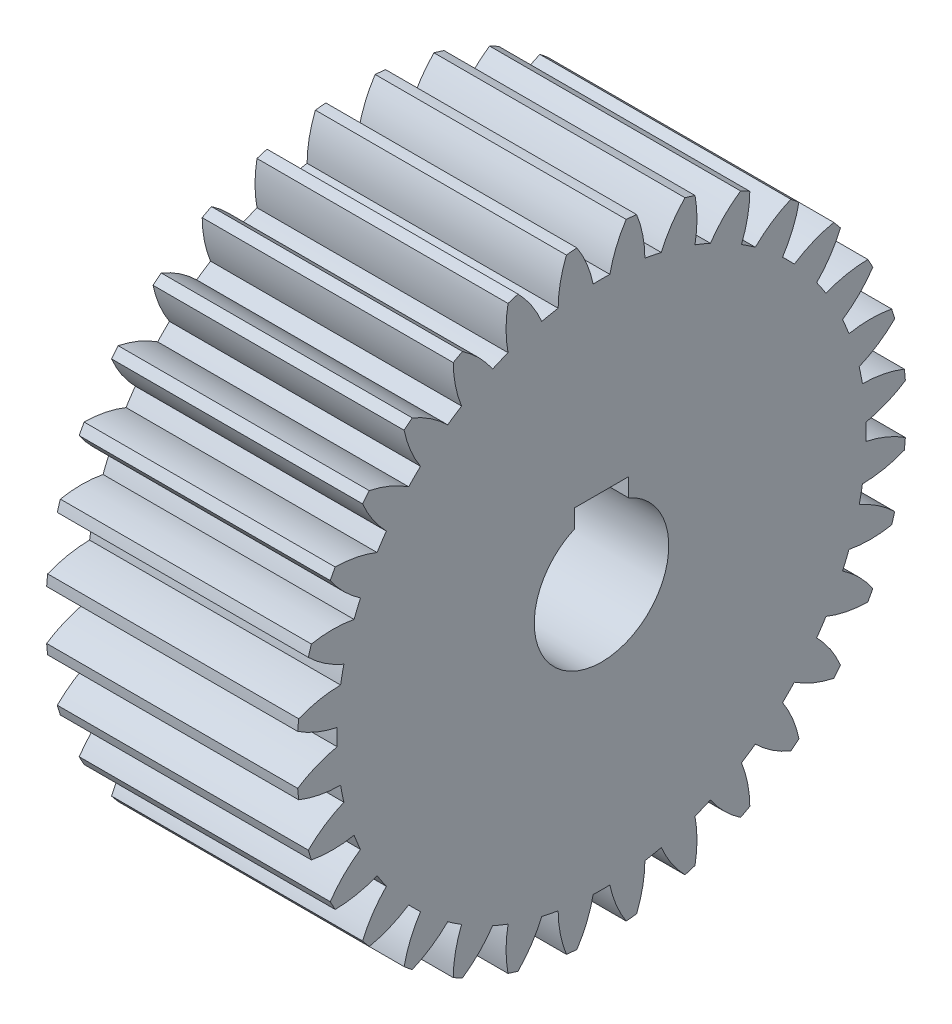
from build123d import *

# Parameters (mm, degrees)
BASPROSKE_W     = 59.266666667
BASPROSKE_H     = 71.966666667
TOOTHCUT_DEPTH  = 118.774954893
TEETHCUTS_COUNT = 32
TEETHCUTS_ANGLE = 348.75
BORSKE_R        = 15.875
BORE_DEPTH      = 59.266717467
KEYSKE_W        = 12.7
KEYSKE_H        = 18.8468
KEYWAY_DEPTH    = 59.266717467


with BuildPart() as part:
    # BasProSke → Base-Revolve (revolve)
    with BuildSketch(Plane(origin=(0, 0, 0), x_dir=(1, 0, 0), z_dir=(0, 1, 0)), mode=Mode.PRIVATE) as base_revolve_sk:
        with Locations((29.633333334, 35.983333333)):
            Rectangle(BASPROSKE_W, BASPROSKE_H)
    revolve(base_revolve_sk.sketch.rotate(Axis((-10, 0, 0), (1, 0, 0)), 180), axis=Axis((-10, 0, 0), (1, 0, 0)))

    # TooCutSke → ToothCut (cut, through all)
    with BuildSketch(Plane(origin=(0, 0, 0), x_dir=(0, 0, -1), z_dir=(1, 0, 0))):
        with BuildLine():
            ThreePointArc((1.971598238, 62.409261623), (0, 62.440396667), (-1.971598238, 62.409261623))
            ThreePointArc((-1.971598238, 62.409261623), (-3.464028334, 67.264109672), (-5.836343479, 71.75510266))
            ThreePointArc((-5.836343479, 71.75510266), (0, 71.992066667), (5.836343479, 71.75510266))
            ThreePointArc((5.836343479, 71.75510266), (3.464028334, 67.264109672), (1.971598238, 62.409261623))
        make_face()
    toothcut = extrude(amount=TOOTHCUT_DEPTH, mode=Mode.SUBTRACT)

    # TeethCuts: ToothCut ×32 about axis
    teethcuts_axis = Axis((-10, 0, 0), (1, 0, 0))
    for i in range(1, TEETHCUTS_COUNT):
        add(toothcut.rotate(teethcuts_axis, i * TEETHCUTS_ANGLE / (TEETHCUTS_COUNT - 1)), mode=Mode.SUBTRACT)

    # BorSke → Bore (cut, symmetric)
    with BuildSketch(Plane(origin=(0, 0, 0), x_dir=(0, 0, -1), z_dir=(1, 0, 0))):
        with Locations(Location((0, 0, 0), (0, 0, 180))):
            Circle(BORSKE_R)
    extrude(amount=BORE_DEPTH, both=True, mode=Mode.SUBTRACT)

    # KeySke → Keyway (cut, symmetric)
    with BuildSketch(Plane(origin=(0, 0, 0), x_dir=(0, 0, -1), z_dir=(1, 0, 0))):
        with Locations((0, 9.4234)):
            Rectangle(KEYSKE_W, KEYSKE_H)
    extrude(amount=KEYWAY_DEPTH, both=True, mode=Mode.SUBTRACT)


solid = part.part
